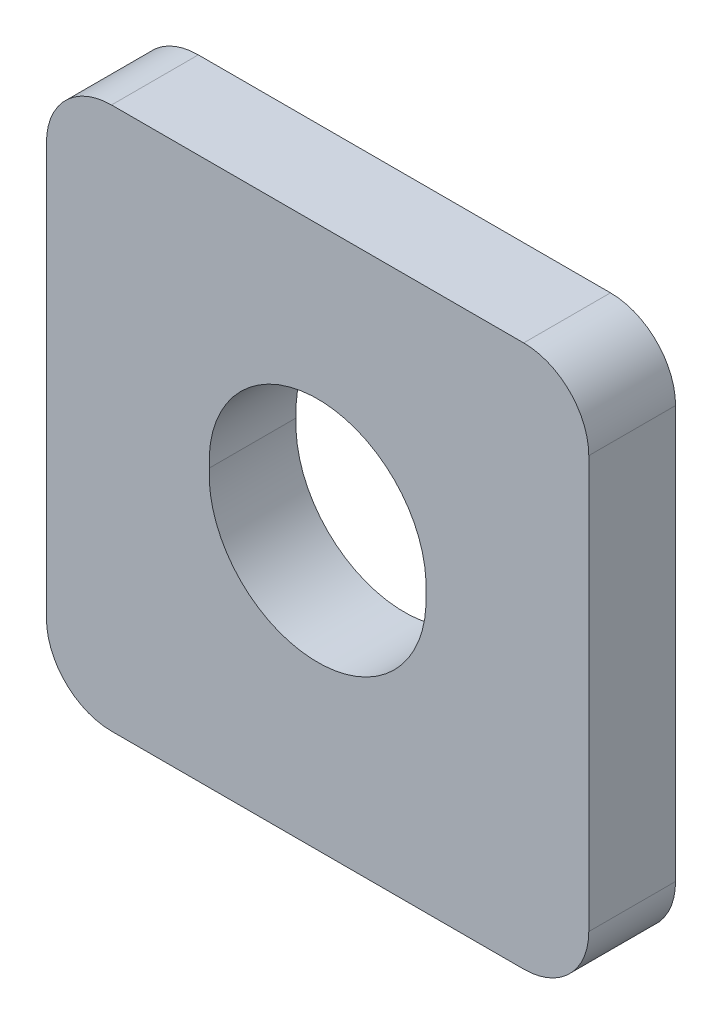
from build123d import *

# Parameters (mm, degrees)
ESQUISSE1_R          = 5
BOSS_EXTRU_1_DEPTH   = 4
D_GAGEMENT_M82_D     = 10
D_GAGEMENT_M82_DEPTH = 222.5
D_GAGEMENT_M82_TIP   = 3.004303095


with BuildPart() as part:
    # Esquisse1 → Boss.-Extru.1 (new body)
    with BuildSketch(Plane.XY):
        with BuildLine():
            Line((-9.5, -12.5), (9.5, -12.5))
            ThreePointArc((9.5, -12.5), (11.621320344, -11.621320344), (12.5, -9.5))
            Line((12.5, -9.5), (12.5, 9.5))
            ThreePointArc((12.5, 9.5), (11.621320344, 11.621320344), (9.5, 12.5))
            Line((9.5, 12.5), (-9.5, 12.5))
            ThreePointArc((-9.5, 12.5), (-11.621320344, 11.621320344), (-12.5, 9.5))
            Line((-12.5, 9.5), (-12.5, -9.5))
            ThreePointArc((-12.5, -9.5), (-11.621320344, -11.621320344), (-9.5, -12.5))
        make_face()
        Circle(ESQUISSE1_R, mode=Mode.SUBTRACT)
    extrude(amount=BOSS_EXTRU_1_DEPTH)

    # Dégagement M82
    with Locations(Plane(origin=(0, -679.483503367, 39), x_dir=(1, 0, 0), z_dir=(0, 0, 1))):
        with Locations((0, 680), (0, 580), (0, 480)):
            Hole(D_GAGEMENT_M82_D / 2, depth=D_GAGEMENT_M82_DEPTH)
            with Locations((0, 0, -(D_GAGEMENT_M82_DEPTH + D_GAGEMENT_M82_TIP / 2))):  # 118° drill point
                Cone(0, D_GAGEMENT_M82_D / 2, D_GAGEMENT_M82_TIP, mode=Mode.SUBTRACT)


solid = part.part
